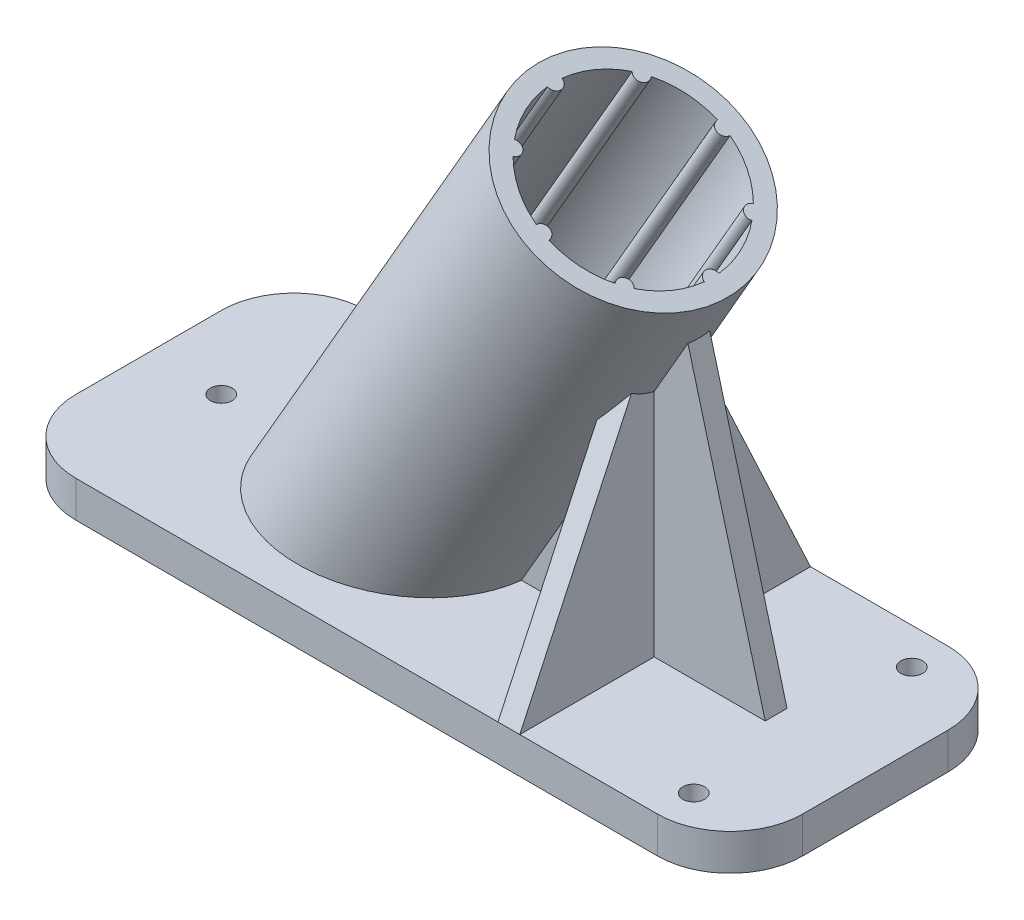
from build123d import *

# Parameters (mm, degrees)
BOSS_EXTRUDE1_DEPTH = 5
BOSS_EXTRUDE2_REACH = 98.884
SKETCH2_R           = 15
SKETCH2_R_2         = 12.5
BOSS_EXTRUDE3_REACH = 98.884
SKETCH3_R           = 1
RIB1_REACH          = 87.478
SKETCH4_WALL_W      = 198.83792102
SKETCH4_WALL_H      = 3
RIB2_REACH          = 100.216
SKETCH5_WALL_W      = 242.211652072
SKETCH5_WALL_H      = 3
SKETCH6_R           = 1.5
CUT_EXTRUDE1_DEPTH  = 5


with BuildPart() as part:
    # Sketch1 → Boss-Extrude1 (new body)
    with BuildSketch(Plane(origin=(0, 0, 0), x_dir=(1, 0, 0), z_dir=(0, 1, 0))):
        with BuildLine():
            Line((40, 20), (-40, 20))
            ThreePointArc((-40, 20), (-47.071067812, 17.071067812), (-50, 10))
            Line((-50, 10), (-50, -10))
            ThreePointArc((-50, -10), (-47.071067812, -17.071067812), (-40, -20))
            Line((-40, -20), (40, -20))
            ThreePointArc((40, -20), (47.071067812, -17.071067812), (50, -10))
            Line((50, -10), (50, 10))
            ThreePointArc((50, 10), (47.071067812, 17.071067812), (40, 20))
        make_face()
    extrude(amount=BOSS_EXTRUDE1_DEPTH)

    # Boss-Extrude2: up to this plane
    boss_extrude2_end = Plane(origin=(40, 5, 10), z_dir=(0, -1, 0))
    # Sketch2 → Boss-Extrude2 (add, up to the surface)
    with BuildSketch(Plane(origin=(29.665063509, 51.381397208, 0), x_dir=(0, 0, -1), z_dir=(0.500000000000001, 0.866025403784438, 0)), mode=Mode.PRIVATE) as boss_extrude2_sk1:
        with Locations(Location((0, 15, 0), (0, 0, 90))):
            Circle(SKETCH2_R)
        with Locations(Location((0, 15, 0), (0, 0, 90))):
            Circle(SKETCH2_R_2, mode=Mode.SUBTRACT)
    boss_extrude2_tool1 = split(extrude(boss_extrude2_sk1.sketch, amount=-BOSS_EXTRUDE2_REACH, mode=Mode.PRIVATE), bisect_by=boss_extrude2_end, keep=Keep.BOTH, mode=Mode.PRIVATE)
    add(boss_extrude2_tool1.solids().sort_by_distance((29.29764, 51.593529, 0))[0])

    # Boss-Extrude3: up to this plane
    boss_extrude3_end = Plane(origin=(40, 5, 10), z_dir=(0, -1, 0))
    # Sketch3 → Boss-Extrude3 (add, up to the surface)
    with BuildSketch(Plane(origin=(29.665063509, 51.381397208, 0), x_dir=(0.8660254037844382, -0.500000000000001, 0), z_dir=(0.500000000000001, 0.8660254037844382, 0)), mode=Mode.PRIVATE) as boss_extrude3_sk1:
        with Locations((-2.5, 0)):
            Circle(SKETCH3_R)
    boss_extrude3_tool1 = split(extrude(boss_extrude3_sk1.sketch, amount=-BOSS_EXTRUDE3_REACH, mode=Mode.PRIVATE), bisect_by=boss_extrude3_end, keep=Keep.BOTH, mode=Mode.PRIVATE)
    add(boss_extrude3_tool1.solids().sort_by_distance((27.5, 52.631397, 0))[0])
    # Sketch3 → Boss-Extrude3 (add, up to the surface)
    with BuildSketch(Plane(origin=(29.665063509, 51.381397208, 0), x_dir=(0.8660254037844382, -0.500000000000001, 0), z_dir=(0.500000000000001, 0.8660254037844382, 0)), mode=Mode.PRIVATE) as boss_extrude3_sk2:
        with Locations((-6.161165235, -8.838834765)):
            Circle(SKETCH3_R)
    boss_extrude3_tool2 = split(extrude(boss_extrude3_sk2.sketch, amount=-BOSS_EXTRUDE3_REACH, mode=Mode.PRIVATE), bisect_by=boss_extrude3_end, keep=Keep.BOTH, mode=Mode.PRIVATE)
    add(boss_extrude3_tool2.solids().sort_by_distance((24.329338, 54.46198, 8.838835))[0])
    # Sketch3 → Boss-Extrude3 (add, up to the surface)
    with BuildSketch(Plane(origin=(29.665063509, 51.381397208, 0), x_dir=(0.8660254037844382, -0.500000000000001, 0), z_dir=(0.500000000000001, 0.8660254037844382, 0)), mode=Mode.PRIVATE) as boss_extrude3_sk3:
        with Locations((-15, -12.5)):
            Circle(SKETCH3_R)
    boss_extrude3_tool3 = split(extrude(boss_extrude3_sk3.sketch, amount=-BOSS_EXTRUDE3_REACH, mode=Mode.PRIVATE), bisect_by=boss_extrude3_end, keep=Keep.BOTH, mode=Mode.PRIVATE)
    add(boss_extrude3_tool3.solids().sort_by_distance((16.674682, 58.881397, 12.5))[0])
    # Sketch3 → Boss-Extrude3 (add, up to the surface)
    with BuildSketch(Plane(origin=(29.665063509, 51.381397208, 0), x_dir=(0.8660254037844382, -0.500000000000001, 0), z_dir=(0.500000000000001, 0.8660254037844382, 0)), mode=Mode.PRIVATE) as boss_extrude3_sk4:
        with Locations((-23.838834765, -8.838834765)):
            Circle(SKETCH3_R)
    boss_extrude3_tool4 = split(extrude(boss_extrude3_sk4.sketch, amount=-BOSS_EXTRUDE3_REACH, mode=Mode.PRIVATE), bisect_by=boss_extrude3_end, keep=Keep.BOTH, mode=Mode.PRIVATE)
    add(boss_extrude3_tool4.solids().sort_by_distance((9.020027, 63.300815, 8.838835))[0])
    # Sketch3 → Boss-Extrude3 (add, up to the surface)
    with BuildSketch(Plane(origin=(29.665063509, 51.381397208, 0), x_dir=(0.8660254037844382, -0.500000000000001, 0), z_dir=(0.500000000000001, 0.8660254037844382, 0)), mode=Mode.PRIVATE) as boss_extrude3_sk5:
        with Locations((-27.5, 0)):
            Circle(SKETCH3_R)
    boss_extrude3_tool5 = split(extrude(boss_extrude3_sk5.sketch, amount=-BOSS_EXTRUDE3_REACH, mode=Mode.PRIVATE), bisect_by=boss_extrude3_end, keep=Keep.BOTH, mode=Mode.PRIVATE)
    add(boss_extrude3_tool5.solids().sort_by_distance((5.849365, 65.131397, 0))[0])
    # Sketch3 → Boss-Extrude3 (add, up to the surface)
    with BuildSketch(Plane(origin=(29.665063509, 51.381397208, 0), x_dir=(0.8660254037844382, -0.500000000000001, 0), z_dir=(0.500000000000001, 0.8660254037844382, 0)), mode=Mode.PRIVATE) as boss_extrude3_sk6:
        with Locations((-23.838834765, 8.838834765)):
            Circle(SKETCH3_R)
    boss_extrude3_tool6 = split(extrude(boss_extrude3_sk6.sketch, amount=-BOSS_EXTRUDE3_REACH, mode=Mode.PRIVATE), bisect_by=boss_extrude3_end, keep=Keep.BOTH, mode=Mode.PRIVATE)
    add(boss_extrude3_tool6.solids().sort_by_distance((9.020027, 63.300815, -8.838835))[0])
    # Sketch3 → Boss-Extrude3 (add, up to the surface)
    with BuildSketch(Plane(origin=(29.665063509, 51.381397208, 0), x_dir=(0.8660254037844382, -0.500000000000001, 0), z_dir=(0.500000000000001, 0.8660254037844382, 0)), mode=Mode.PRIVATE) as boss_extrude3_sk7:
        with Locations((-15, 12.5)):
            Circle(SKETCH3_R)
    boss_extrude3_tool7 = split(extrude(boss_extrude3_sk7.sketch, amount=-BOSS_EXTRUDE3_REACH, mode=Mode.PRIVATE), bisect_by=boss_extrude3_end, keep=Keep.BOTH, mode=Mode.PRIVATE)
    add(boss_extrude3_tool7.solids().sort_by_distance((16.674682, 58.881397, -12.5))[0])
    # Sketch3 → Boss-Extrude3 (add, up to the surface)
    with BuildSketch(Plane(origin=(29.665063509, 51.381397208, 0), x_dir=(0.8660254037844382, -0.500000000000001, 0), z_dir=(0.500000000000001, 0.8660254037844382, 0)), mode=Mode.PRIVATE) as boss_extrude3_sk8:
        with Locations((-6.161165235, 8.838834765)):
            Circle(SKETCH3_R)
    boss_extrude3_tool8 = split(extrude(boss_extrude3_sk8.sketch, amount=-BOSS_EXTRUDE3_REACH, mode=Mode.PRIVATE), bisect_by=boss_extrude3_end, keep=Keep.BOTH, mode=Mode.PRIVATE)
    add(boss_extrude3_tool8.solids().sort_by_distance((24.329338, 54.46198, -8.838835))[0])

    # Sketch4 wall → Rib1 (add, up to next)
    with BuildSketch(Plane(origin=(31.650635095, 22.5, 0), x_dir=(0.258819045111, -0.965925826287, 0), z_dir=(0.965925826287, 0.258819045111, 0)), mode=Mode.PRIVATE) as rib1_sk1:
        Rectangle(SKETCH4_WALL_W, SKETCH4_WALL_H)
    rib1_tool1 = extrude(rib1_sk1.sketch, amount=-RIB1_REACH, mode=Mode.PRIVATE) - part.part
    add(rib1_tool1.solids().sort_by_distance((31.650635095, 22.5, 0))[0])

    # Sketch5 wall → Rib2 (add, up to next)
    with BuildSketch(Plane(origin=(19.569838586, 24.839013436, 10.75), x_dir=(0, -0.906326752135, 0.422577588573), z_dir=(0, -0.422577588573, -0.906326752135)), mode=Mode.PRIVATE) as rib2_sk1:
        Rectangle(SKETCH5_WALL_W, SKETCH5_WALL_H)
    rib2_tool1 = extrude(rib2_sk1.sketch, amount=RIB2_REACH, mode=Mode.PRIVATE) - part.part
    rib2 = rib2_tool1.solids().sort_by_distance((19.569838586, 24.839013436, 10.75))[0]
    add(rib2)

    # Mirror2: Rib2 across plane
    add(rib2.mirror(Plane.XY))

    # Sketch6 → Cut-Extrude1 (cut)
    with BuildSketch(Plane(origin=(0, 0, 0), x_dir=(-1, 0, 0), z_dir=(0, -1, 0))):
        with Locations(Location((-40, 15, 0), (0, 0, 90))):
            Circle(SKETCH6_R)
        with Locations(Location((-40, -15, 0), (0, 0, 90))):
            Circle(SKETCH6_R)
        with Locations(Location((40, 0, 0), (0, 0, 90))):
            Circle(SKETCH6_R)
    extrude(amount=-CUT_EXTRUDE1_DEPTH, mode=Mode.SUBTRACT)


solid = part.part
